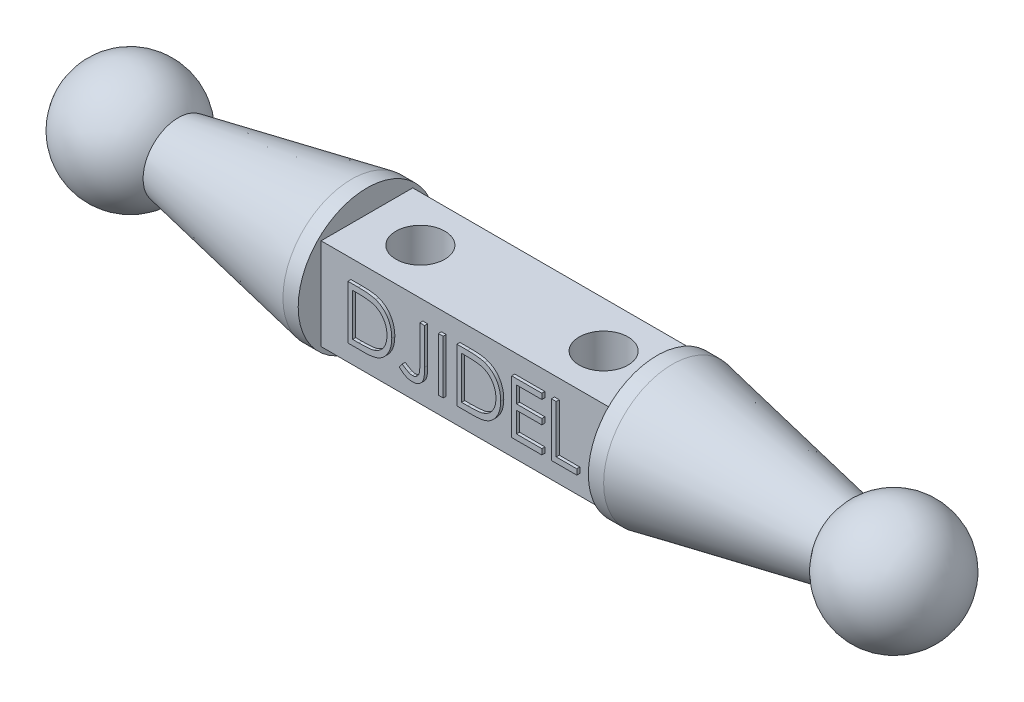
from build123d import *

# Parameters (mm, degrees)
BOSS_EXTRU_1_DEPTH      = 9.5
BOSS_EXTRU_1_DEPTH_BACK = 9.5
ESQUISSE4_W             = 6
ESQUISSE4_H             = 6
ESQUISSE5_R             = 1.6
ENL_V_MAT_EXTRU_1_DEPTH = 9.5
BOSS_EXTRU_2_DEPTH      = 0.2
BOSS_EXTRU_2_2_DEPTH    = 0.2
ESQUISSE6_W             = 0.314102564
ESQUISSE6_H             = 3.5
BOSS_EXTRU_2_3_DEPTH    = 0.2
BOSS_EXTRU_2_4_DEPTH    = 0.2
BOSS_EXTRU_2_5_DEPTH    = 0.2
BOSS_EXTRU_2_6_DEPTH    = 0.2


with BuildPart() as part:
    # Esquisse1 → Révolution1 (revolve)
    with BuildSketch(Plane(origin=(0, 0, 0), x_dir=(1, 0, 0), z_dir=(0, 1, 0))):
        with BuildLine():
            Line((-9.5, 0), (-9.5, 4.5))
            Line((-9.5, 4.5), (-10.5, 4.5))
            Line((-10.5, 4.5), (-21.853185079, 2.303813328))
            ThreePointArc((-21.853185079, 2.303813328), (-26.211903834, 3.706924479), (-28.9, 0))
            Line((-28.9, 0), (-9.5, 0))
        make_face()
        with BuildLine():
            Line((9.5, 0), (28.9, 0))
            ThreePointArc((28.9, 0), (26.211903834, 3.706924479), (21.853185079, 2.303813328))
            Line((21.853185079, 2.303813328), (10.5, 4.5))
            Line((10.5, 4.5), (9.5, 4.5))
            Line((9.5, 4.5), (9.5, 0))
        make_face()
    revolve(axis=Axis((-27.948705607, 0, 0), (1, 0, 0)))

    # Esquisse4 → Boss.-Extru.1 (add, two sides: drawn at the far end of the back side and taken through both)
    with BuildSketch(Plane(origin=(0, 0, 0), x_dir=(0, 0, -1), z_dir=(1, 0, 0)).offset(-BOSS_EXTRU_1_DEPTH_BACK)):
        Rectangle(ESQUISSE4_W, ESQUISSE4_H)
    extrude(amount=BOSS_EXTRU_1_DEPTH + BOSS_EXTRU_1_DEPTH_BACK)

    # Esquisse5 → Enlèv. mat.-Extru.1 (cut)
    with BuildSketch(Plane(origin=(0, 3, 0), x_dir=(1, 0, 0), z_dir=(0, 1, 0))):
        with Locations((-6, 0)):
            Circle(ESQUISSE5_R)
        with Locations((6, 0)):
            Circle(ESQUISSE5_R)
    extrude(amount=-ENL_V_MAT_EXTRU_1_DEPTH, mode=Mode.SUBTRACT)


with BuildPart() as body_2:
    # Esquisse6 → Boss.-Extru.2 (new body)
    with BuildSketch(Plane.XY.offset(3)):
        with BuildLine():
            Line((-7.545473972, -1.71750217), (-7.545473972, 1.78249783))
            Line((-7.545473972, 1.78249783), (-6.838743203, 1.78249783))
            add(Edge.make_bspline(
                [(-6.838743203, 1.78249783), (-6.777274215, 1.78205526), (-6.658516449, 1.781200217), (-6.486904002, 1.775778825), (-6.328120239, 1.76618836), (-6.18268738, 1.752218833), (-6.050206168, 1.7350658), (-5.93104756, 1.713565396), (-5.824595417, 1.688177225), (-5.759125977, 1.666531775), (-5.72816628, 1.656295906)],
                knots=[0, 0, 0, 0, 1.314313732, 2.53924729, 3.670748893, 4.714932338, 5.66265055, 6.526160246, 7.303039223, 8, 8, 8, 8], degree=3))
            add(Edge.make_bspline(
                [(-5.72816628, 1.656295906), (-5.68767154, 1.640865201), (-5.607600348, 1.610353707), (-5.493593226, 1.552797405), (-5.386267863, 1.487584304), (-5.285048718, 1.414628441), (-5.192247891, 1.331864092), (-5.104239995, 1.242807007), (-5.024625271, 1.144218667), (-4.951716975, 1.038143679), (-4.885981315, 0.925831626), (-4.828842157, 0.807496518), (-4.781388164, 0.68373931), (-4.741994937, 0.554904162), (-4.71094848, 0.420707784), (-4.689766548, 0.280993918), (-4.675795558, 0.136314728), (-4.674391507, 0.038140265), (-4.6736791, -0.011672844)],
                knots=[0, 0, 0, 0, 0.984719456, 1.947108742, 2.898477687, 3.838006223, 4.779231079, 5.722358779, 6.681677486, 7.655904652, 8.64651281, 9.637519902, 10.640069247, 11.656948941, 12.698408672, 13.768548281, 14.867775369, 16, 16, 16, 16], degree=3))
            add(Edge.make_bspline(
                [(-4.6736791, -0.011672844), (-4.674308068, -0.054934082), (-4.675547514, -0.140184871), (-4.68667683, -0.265825767), (-4.70285315, -0.387739338), (-4.727897348, -0.505345038), (-4.758299861, -0.619673256), (-4.797264012, -0.7295055), (-4.841899508, -0.83584931), (-4.893949387, -0.937266785), (-4.951090772, -1.033350158), (-5.012412515, -1.123925686), (-5.077849211, -1.207700908), (-5.148024844, -1.28492952), (-5.22203256, -1.355495098), (-5.300356891, -1.419987113), (-5.383199941, -1.477143668), (-5.470190664, -1.529210777), (-5.563866793, -1.574631132), (-5.666002659, -1.613061142), (-5.777033837, -1.644907757), (-5.896687794, -1.671478653), (-6.025171272, -1.692555956), (-6.162610238, -1.706682348), (-6.308793528, -1.716235281), (-6.409172793, -1.717071674), (-6.460838555, -1.71750217)],
                knots=[0, 0, 0, 0, 1.105936401, 2.179363191, 3.223086493, 4.248585256, 5.251745608, 6.245858792, 7.225916811, 8.198733463, 9.158002045, 10.082870192, 10.993790845, 11.873723703, 12.748670949, 13.606408763, 14.465103618, 15.319838547, 16.196477973, 17.123216899, 18.106603292, 19.147568657, 20.255746949, 21.433717677, 22.679120308, 24, 24, 24, 24], degree=3))
            Line((-6.460838555, -1.71750217), (-7.545473972, -1.71750217))
        make_face()
        with BuildLine():
            Line((-7.231371408, -1.358527811), (-6.829628619, -1.358527811))
            add(Edge.make_bspline(
                [(-6.829628619, -1.358527811), (-6.771900249, -1.358279715), (-6.66086745, -1.357802535), (-6.501209453, -1.353615332), (-6.355330057, -1.346773394), (-6.223208547, -1.337198316), (-6.104919523, -1.324529701), (-6.000215773, -1.310404799), (-5.909440515, -1.292807348), (-5.854511078, -1.276856388), (-5.829127818, -1.269485344)],
                knots=[0, 0, 0, 0, 1.375205317, 2.645023457, 3.804390687, 4.853969522, 5.800190428, 6.637939096, 7.370582563, 8, 8, 8, 8], degree=3))
            add(Edge.make_bspline(
                [(-5.829127818, -1.269485344), (-5.797179456, -1.258233785), (-5.734045818, -1.235999412), (-5.643164733, -1.195441751), (-5.558407728, -1.147399681), (-5.478297703, -1.093997407), (-5.403971047, -1.033351405), (-5.334546931, -0.966780416), (-5.27016513, -0.893945641), (-5.211490822, -0.81493748), (-5.158982518, -0.730247684), (-5.113511288, -0.64070885), (-5.073659757, -0.54730204), (-5.042381164, -0.448592881), (-5.01786558, -0.345463823), (-5.000500892, -0.23790761), (-4.989686167, -0.125944328), (-4.988424719, -0.049792204), (-4.987781664, -0.010971722)],
                knots=[0, 0, 0, 0, 0.998632004, 1.973411704, 2.929992603, 3.868527914, 4.809262121, 5.754881198, 6.702106254, 7.672490631, 8.653608572, 9.636854334, 10.631411391, 11.644891563, 12.686317036, 13.754757253, 14.855430412, 16, 16, 16, 16], degree=3))
            add(Edge.make_bspline(
                [(-4.987781664, -0.010971722), (-4.988294952, 0.029961759), (-4.989303309, 0.110375943), (-5.00197762, 0.228366638), (-5.020499175, 0.341847289), (-5.047282861, 0.450825484), (-5.08141374, 0.555513836), (-5.124008382, 0.655333346), (-5.172675001, 0.751338215), (-5.230578338, 0.841312581), (-5.293993931, 0.92640569), (-5.364371811, 1.004360606), (-5.440593849, 1.075354906), (-5.521828699, 1.140494219), (-5.610365798, 1.197157895), (-5.704119489, 1.247844576), (-5.80446516, 1.290860467), (-5.874277856, 1.31373933), (-5.909756825, 1.325366419)],
                knots=[0, 0, 0, 0, 1.122418816, 2.205001699, 3.251619955, 4.274784885, 5.280384055, 6.268708349, 7.249350384, 8.229342522, 9.199999885, 10.157847722, 11.105861043, 12.055065948, 13.010012805, 13.98527497, 14.976112212, 16, 16, 16, 16], degree=3))
            add(Edge.make_bspline(
                [(-5.909756825, 1.325366419), (-5.939107971, 1.333482847), (-6.001516561, 1.3507406), (-6.103356025, 1.369565972), (-6.217971175, 1.386170471), (-6.345870876, 1.400228511), (-6.486909335, 1.410315832), (-6.641195023, 1.417887147), (-6.808794627, 1.422993779), (-6.924977161, 1.423342486), (-6.985277658, 1.423523471)],
                knots=[0, 0, 0, 0, 0.674548936, 1.434276114, 2.292660221, 3.240891867, 4.284742987, 5.42552168, 6.663806718, 8, 8, 8, 8], degree=3))
            Line((-6.985277658, 1.423523471), (-7.231371408, 1.423523471))
            Line((-7.231371408, 1.423523471), (-7.231371408, -1.358527811))
        make_face(mode=Mode.SUBTRACT)
    extrude(amount=BOSS_EXTRU_2_DEPTH)


with BuildPart() as body_3:
    # Esquisse6 → Boss.-Extru.2 2 (new body)
    with BuildSketch(Plane.XY.offset(3)):
        with BuildLine():
            Line((-2.83393551, 1.78249783), (-2.519832946, 1.78249783))
            Line((-2.519832946, 1.78249783), (-2.519832946, -0.580983741))
            add(Edge.make_bspline(
                [(-2.519832946, -0.580983741), (-2.520146865, -0.624688912), (-2.520749627, -0.708608173), (-2.524064038, -0.829482069), (-2.530197516, -0.939852755), (-2.539132528, -1.039971202), (-2.551052761, -1.129523757), (-2.564693789, -1.209202375), (-2.581206588, -1.278342058), (-2.606073054, -1.355977413), (-2.646847003, -1.441121218), (-2.708214041, -1.533076369), (-2.784446837, -1.613509779), (-2.87274787, -1.683362504), (-2.973888894, -1.739019735), (-3.085787114, -1.778974914), (-3.207753701, -1.80334577), (-3.292352913, -1.805919676), (-3.335938716, -1.80724576)],
                knots=[0, 0, 0, 0, 1.237770943, 2.376671248, 3.424123796, 4.367912054, 5.222547132, 5.982086412, 6.656319012, 7.234008312, 8.288027371, 9.317870876, 10.352700517, 11.413286737, 12.494591526, 13.606319346, 14.766767577, 16, 16, 16, 16], degree=3))
            add(Edge.make_bspline(
                [(-3.335938716, -1.80724576), (-3.369897074, -1.806165151), (-3.43822354, -1.803990894), (-3.539914249, -1.786269181), (-3.641316224, -1.758953138), (-3.742967673, -1.718950542), (-3.846876915, -1.664544944), (-3.954451261, -1.593360127), (-4.067074452, -1.505528601), (-4.141257738, -1.438490855), (-4.180089357, -1.403399606)],
                knots=[0, 0, 0, 0, 0.848567217, 1.707373443, 2.573483905, 3.470863513, 4.432650262, 5.500696352, 6.691726801, 8, 8, 8, 8], degree=3))
            Line((-4.180089357, -1.403399606), (-3.994993203, -1.134168837))
            add(Edge.make_bspline(
                [(-3.994993203, -1.134168837), (-3.952290524, -1.163616233), (-3.871662298, -1.219216757), (-3.753157857, -1.290743357), (-3.648160704, -1.352068523), (-3.579477756, -1.383320802), (-3.547677498, -1.397790632)],
                knots=[0, 0, 0, 0, 1.196737151, 2.259595785, 3.194191475, 4, 4, 4, 4], degree=3))
            add(Edge.make_bspline(
                [(-3.547677498, -1.397790632), (-3.528393186, -1.405350089), (-3.490572357, -1.420175869), (-3.432747277, -1.436721767), (-3.37525224, -1.445764177), (-3.337134546, -1.44744551), (-3.318410671, -1.448271401)],
                knots=[0, 0, 0, 0, 1.051806502, 2.062826769, 3.048436908, 4, 4, 4, 4], degree=3))
            add(Edge.make_bspline(
                [(-3.318410671, -1.448271401), (-3.294227882, -1.447248666), (-3.246427426, -1.445227096), (-3.176963432, -1.427377821), (-3.110505401, -1.400133418), (-3.049435743, -1.360242124), (-2.993150356, -1.312810704), (-2.94670753, -1.255454695), (-2.907990286, -1.191888711), (-2.884690593, -1.131717257), (-2.869845821, -1.076840627), (-2.860424194, -1.026407491), (-2.852185533, -0.967446013), (-2.845003981, -0.899885812), (-2.840799511, -0.82359163), (-2.836082238, -0.738787487), (-2.834376977, -0.645259575), (-2.834087156, -0.580048623), (-2.83393551, -0.545927651)],
                knots=[0, 0, 0, 0, 0.997221856, 1.971139923, 2.944579524, 3.951425367, 4.971190333, 5.972282193, 6.985401279, 8.033996657, 8.624075553, 9.332086008, 10.151144245, 11.082816738, 12.137127781, 13.306538797, 14.590673636, 16, 16, 16, 16], degree=3))
            Line((-2.83393551, -0.545927651), (-2.83393551, 1.78249783))
        make_face()
    extrude(amount=BOSS_EXTRU_2_2_DEPTH)


with BuildPart() as body_4:
    # Esquisse6 → Boss.-Extru.2 3 (new body)
    with BuildSketch(Plane.XY.offset(3)):
        with Locations((-1.465345767, 0.03249783)):
            Rectangle(ESQUISSE6_W, ESQUISSE6_H)
    extrude(amount=BOSS_EXTRU_2_3_DEPTH)


with BuildPart() as body_5:
    # Esquisse6 → Boss.-Extru.2 4 (new body)
    with BuildSketch(Plane.XY.offset(3)):
        with BuildLine():
            Line((-0.410858587, -1.71750217), (-0.410858587, 1.78249783))
            Line((-0.410858587, 1.78249783), (0.295872182, 1.78249783))
            add(Edge.make_bspline(
                [(0.295872182, 1.78249783), (0.35734117, 1.78205526), (0.476098935, 1.781200217), (0.647711383, 1.775778825), (0.806495145, 1.76618836), (0.951928004, 1.752218833), (1.084409216, 1.7350658), (1.203567824, 1.713565396), (1.310019967, 1.688177225), (1.375489408, 1.666531775), (1.406449105, 1.656295906)],
                knots=[0, 0, 0, 0, 1.314313732, 2.53924729, 3.670748893, 4.714932338, 5.66265055, 6.526160246, 7.303039223, 8, 8, 8, 8], degree=3))
            add(Edge.make_bspline(
                [(1.406449105, 1.656295906), (1.446943844, 1.640865201), (1.527015036, 1.610353707), (1.641022159, 1.552797405), (1.748347522, 1.487584304), (1.849566667, 1.414628441), (1.942367493, 1.331864092), (2.03037539, 1.242807007), (2.109990114, 1.144218667), (2.18289841, 1.038143679), (2.248634069, 0.925831626), (2.305773227, 0.807496518), (2.353227221, 0.68373931), (2.392620447, 0.554904162), (2.423666905, 0.420707784), (2.444848836, 0.280993918), (2.458819826, 0.136314728), (2.460223878, 0.038140265), (2.460936284, -0.011672844)],
                knots=[0, 0, 0, 0, 0.984719456, 1.947108742, 2.898477687, 3.838006223, 4.779231079, 5.722358779, 6.681677486, 7.655904652, 8.64651281, 9.637519902, 10.640069247, 11.656948941, 12.698408672, 13.768548281, 14.867775369, 16, 16, 16, 16], degree=3))
            add(Edge.make_bspline(
                [(2.460936284, -0.011672844), (2.460307317, -0.054934082), (2.459067871, -0.140184871), (2.447938555, -0.265825767), (2.431762235, -0.387739338), (2.406718037, -0.505345038), (2.376315524, -0.619673256), (2.337351372, -0.7295055), (2.292715876, -0.83584931), (2.240665998, -0.937266785), (2.183524613, -1.033350158), (2.122202869, -1.123925686), (2.056766174, -1.207700908), (1.986590541, -1.28492952), (1.912582825, -1.355495098), (1.834258494, -1.419987113), (1.751415443, -1.477143668), (1.664424721, -1.529210777), (1.570748591, -1.574631132), (1.468612725, -1.613061142), (1.357581547, -1.644907757), (1.23792759, -1.671478653), (1.109444112, -1.692555956), (0.972005147, -1.706682348), (0.825821857, -1.716235281), (0.725442592, -1.717071674), (0.673776829, -1.71750217)],
                knots=[0, 0, 0, 0, 1.105936401, 2.179363191, 3.223086493, 4.248585256, 5.251745608, 6.245858792, 7.225916811, 8.198733463, 9.158002045, 10.082870192, 10.993790845, 11.873723703, 12.748670949, 13.606408763, 14.465103618, 15.319838547, 16.196477973, 17.123216899, 18.106603292, 19.147568657, 20.255746949, 21.433717677, 22.679120308, 24, 24, 24, 24], degree=3))
            Line((0.673776829, -1.71750217), (-0.410858587, -1.71750217))
        make_face()
        with BuildLine():
            Line((-0.096756023, -1.358527811), (0.304986765, -1.358527811))
            add(Edge.make_bspline(
                [(0.304986765, -1.358527811), (0.362715136, -1.358279715), (0.473747934, -1.357802535), (0.633405932, -1.353615332), (0.779285328, -1.346773394), (0.911406837, -1.337198316), (1.029695862, -1.324529701), (1.134399612, -1.310404799), (1.22517487, -1.292807348), (1.280104307, -1.276856388), (1.305487566, -1.269485344)],
                knots=[0, 0, 0, 0, 1.375205317, 2.645023457, 3.804390687, 4.853969522, 5.800190428, 6.637939096, 7.370582563, 8, 8, 8, 8], degree=3))
            add(Edge.make_bspline(
                [(1.305487566, -1.269485344), (1.337435929, -1.258233785), (1.400569567, -1.235999412), (1.491450652, -1.195441751), (1.576207657, -1.147399681), (1.656317682, -1.093997407), (1.730644337, -1.033351405), (1.800068454, -0.966780416), (1.864450255, -0.893945641), (1.923124563, -0.81493748), (1.975632867, -0.730247684), (2.021104096, -0.64070885), (2.060955628, -0.54730204), (2.092234221, -0.448592881), (2.116749805, -0.345463823), (2.134114493, -0.23790761), (2.144929217, -0.125944328), (2.146190665, -0.049792204), (2.14683372, -0.010971722)],
                knots=[0, 0, 0, 0, 0.998632004, 1.973411704, 2.929992603, 3.868527914, 4.809262121, 5.754881198, 6.702106254, 7.672490631, 8.653608572, 9.636854334, 10.631411391, 11.644891563, 12.686317036, 13.754757253, 14.855430412, 16, 16, 16, 16], degree=3))
            add(Edge.make_bspline(
                [(2.14683372, -0.010971722), (2.146320433, 0.029961759), (2.145312075, 0.110375943), (2.132637765, 0.228366638), (2.114116209, 0.341847289), (2.087332523, 0.450825484), (2.053201645, 0.555513836), (2.010607003, 0.655333346), (1.961940384, 0.751338215), (1.904037047, 0.841312581), (1.840621453, 0.92640569), (1.770243574, 1.004360606), (1.694021535, 1.075354906), (1.612786686, 1.140494219), (1.524249587, 1.197157895), (1.430495896, 1.247844576), (1.330150225, 1.290860467), (1.260337529, 1.31373933), (1.22485856, 1.325366419)],
                knots=[0, 0, 0, 0, 1.122418816, 2.205001699, 3.251619955, 4.274784885, 5.280384055, 6.268708349, 7.249350384, 8.229342522, 9.199999885, 10.157847722, 11.105861043, 12.055065948, 13.010012805, 13.98527497, 14.976112212, 16, 16, 16, 16], degree=3))
            add(Edge.make_bspline(
                [(1.22485856, 1.325366419), (1.195507414, 1.333482847), (1.133098823, 1.3507406), (1.031259359, 1.369565972), (0.91664421, 1.386170471), (0.788744509, 1.400228511), (0.64770605, 1.410315832), (0.493420362, 1.417887147), (0.325820757, 1.422993779), (0.209638223, 1.423342486), (0.149337727, 1.423523471)],
                knots=[0, 0, 0, 0, 0.674548936, 1.434276114, 2.292660221, 3.240891867, 4.284742987, 5.42552168, 6.663806718, 8, 8, 8, 8], degree=3))
            Line((0.149337727, 1.423523471), (-0.096756023, 1.423523471))
            Line((-0.096756023, 1.423523471), (-0.096756023, -1.358527811))
        make_face(mode=Mode.SUBTRACT)
    extrude(amount=BOSS_EXTRU_2_4_DEPTH)


with BuildPart() as body_6:
    # Esquisse6 → Boss.-Extru.2 5 (new body)
    with BuildSketch(Plane.XY.offset(3)):
        Polygon((3.178885002, 1.78249783), (5.153243977, 1.78249783), (5.153243977, 1.423523471), (3.492987566, 1.423523471), (3.492987566, 0.346600394), (5.153243977, 0.346600394), (5.153243977, -0.012373965), (3.492987566, -0.012373965), (3.492987566, -1.358527811), (5.153243977, -1.358527811), (5.153243977, -1.71750217), (3.178885002, -1.71750217), align=None)
    extrude(amount=BOSS_EXTRU_2_5_DEPTH)


with BuildPart() as body_7:
    # Esquisse6 → Boss.-Extru.2 6 (new body)
    with BuildSketch(Plane.XY.offset(3)):
        Polygon((5.781449105, 1.78249783), (6.095551669, 1.78249783), (6.095551669, -1.358527811), (7.441705515, -1.358527811), (7.441705515, -1.71750217), (5.781449105, -1.71750217), align=None)
    extrude(amount=BOSS_EXTRU_2_6_DEPTH)


solid = Compound([part.part, body_2.part, body_3.part, body_4.part, body_5.part, body_6.part, body_7.part])
